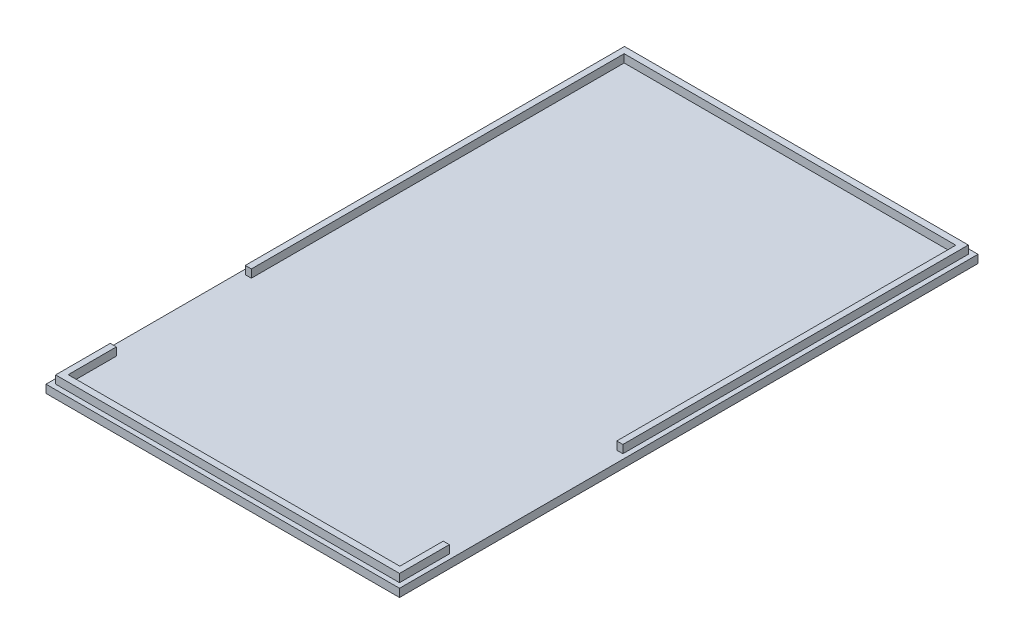
from build123d import *

# Parameters (mm, degrees)
SKETCH1_W           = 110
SKETCH1_H           = 180
BOSS_EXTRUDE1_DEPTH = 1.25
BOSS_EXTRUDE3_DEPTH = 2.5


with BuildPart() as part:
    # Sketch1 → Boss-Extrude1 (new, symmetric)
    with BuildSketch(Plane(origin=(0, 0, 0), x_dir=(1, 0, 0), z_dir=(0, 1, 0))):
        Rectangle(SKETCH1_W, SKETCH1_H)
    extrude(amount=BOSS_EXTRUDE1_DEPTH, both=True)

    # Sketch2 → Boss-Extrude3 (add)
    with BuildSketch(Plane(origin=(0, 1.25, 0), x_dir=(1, 0, 0), z_dir=(0, 1, 0))):
        Polygon((53.5, -88.5), (-53.5, -88.5), (-53.5, -71.5), (-51.6, -71.5), (-51.6, -86.5), (51.6, -86.5), (51.6, -73), (53.5, -73), align=None)
        Polygon((53.5, 88.5), (-53.5, 88.5), (-53.5, -29.5), (-51.6, -29.5), (-51.6, 86.5), (51.6, 86.5), (51.6, -19), (53.5, -19), align=None)
    extrude(amount=BOSS_EXTRUDE3_DEPTH)


solid = part.part
